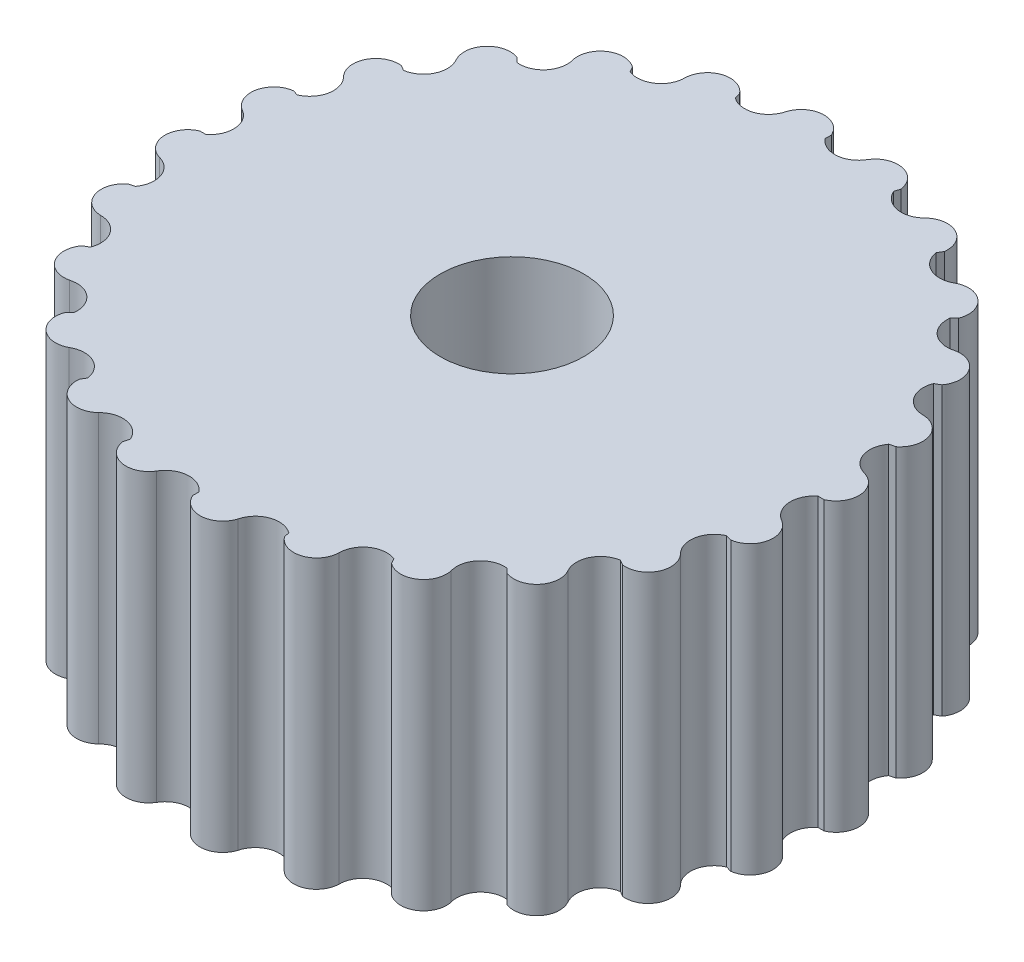
from build123d import *

# Parameters (mm, degrees)
BOSS_EXTRUDE1_DEPTH = 5
CIRPATTERN1_COUNT   = 24


with BuildPart() as part:
    # Sketch1 → Boss-Extrude1 (new body)
    with BuildSketch(Plane(origin=(0, 0, 0), x_dir=(1, 0, 0), z_dir=(0, 1, 0))):
        with BuildLine():
            Line((0, 5.5), (0, 1.25))
            ThreePointArc((0, 1.25), (0.170208311, 1.238357433), (0.337245964, 1.203646609))
            Line((0.337245964, 1.203646609), (1.483882241, 5.29604508))
            ThreePointArc((1.483882241, 5.29604508), (1.169872075, 5.629733504), (0.74891657, 5.448772703))
            ThreePointArc((0.74891657, 5.448772703), (0.35827267, 5.237761038), (0, 5.5))
        make_face()
    boss_extrude1 = extrude(amount=BOSS_EXTRUDE1_DEPTH)

    # CirPattern1: Boss-Extrude1 ×24 about axis
    cirpattern1_axis = Axis((0, 0, 0), (0, 1, 0))
    for i in range(1, CIRPATTERN1_COUNT):
        add(boss_extrude1.rotate(cirpattern1_axis, i * 360 / CIRPATTERN1_COUNT))


solid = part.part
